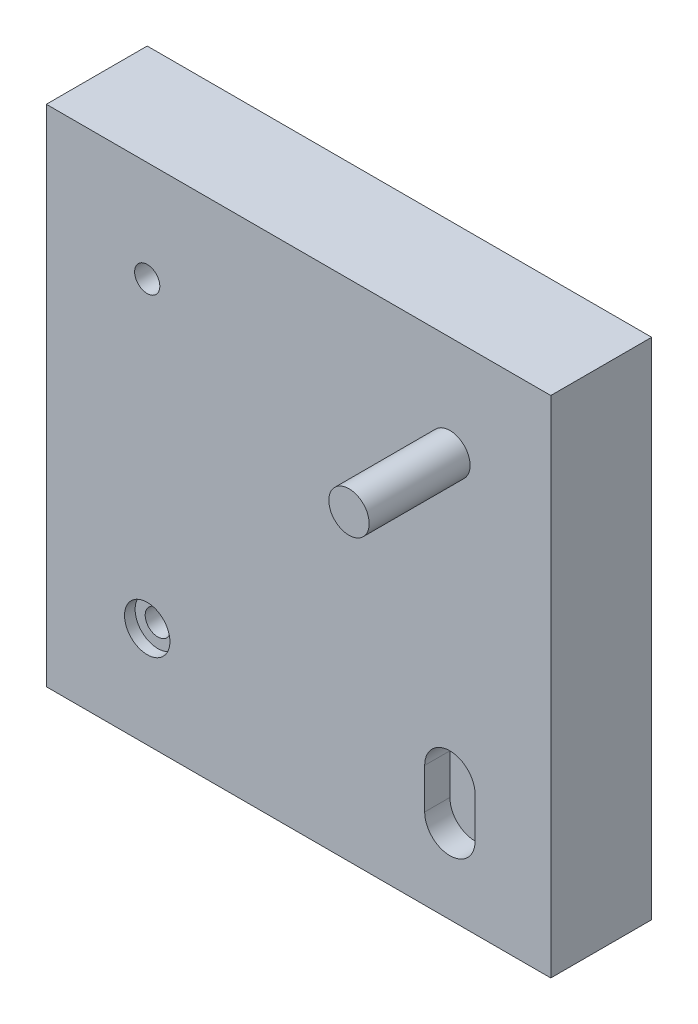
from build123d import *

# Parameters (mm, degrees)
SKIZZE1_W                       = 100
SKIZZE1_H                       = 100
AUFSATZ_LINEAR_AUSTRAGEN1_DEPTH = 20
F_5_0MM_STIFTLOCH1_D            = 5
F_5_0MM_STIFTLOCH1_DEPTH        = 8.5
F_5_0MM_STIFTLOCH1_TIP          = 1.502151548
SKIZZE5_R                       = 4
AUFSATZ_LINEAR_AUSTRAGEN2_DEPTH = 20
BOHRUNG1_D                      = 5
BOHRUNG1_DEPTH                  = 20
BOHRUNG1_CBORE_D                = 9
BOHRUNG1_CBORE_DEPTH            = 2.1
BOHRUNG1_TIP                    = 1.502151548
SCHNITT_LINEAR_AUSTRAGEN1_DEPTH = 5


with BuildPart() as part:
    # Skizze1 → Aufsatz-Linear austragen1 (new body)
    with BuildSketch(Plane.XY):
        Rectangle(SKIZZE1_W, SKIZZE1_H)
    extrude(amount=AUFSATZ_LINEAR_AUSTRAGEN1_DEPTH)

    # Ø5.0mm Stiftloch1
    with Locations(Plane.XY.offset(20)):
        with Locations((-30, 30)):
            Hole(F_5_0MM_STIFTLOCH1_D / 2, depth=F_5_0MM_STIFTLOCH1_DEPTH)
            with Locations((0, 0, -(F_5_0MM_STIFTLOCH1_DEPTH + F_5_0MM_STIFTLOCH1_TIP / 2))):  # 118° drill point
                Cone(0, F_5_0MM_STIFTLOCH1_D / 2, F_5_0MM_STIFTLOCH1_TIP, mode=Mode.SUBTRACT)

    # Skizze5 → Aufsatz-Linear austragen2 (add)
    with BuildSketch(Plane.XY.offset(20)):
        with Locations(Location((30, 30, 0), (0, 0, 180))):
            Circle(SKIZZE5_R)
    extrude(amount=AUFSATZ_LINEAR_AUSTRAGEN2_DEPTH)

    # Bohrung1
    with Locations(Plane.XY.offset(20)):
        with Locations((-30, -30)):
            CounterBoreHole(BOHRUNG1_D / 2, BOHRUNG1_CBORE_D / 2, BOHRUNG1_CBORE_DEPTH, depth=BOHRUNG1_DEPTH)
            with Locations((0, 0, -(BOHRUNG1_DEPTH + BOHRUNG1_TIP / 2))):  # 118° drill point
                Cone(0, BOHRUNG1_D / 2, BOHRUNG1_TIP, mode=Mode.SUBTRACT)

    # Skizze9 → Schnitt-Linear austragen1 (cut)
    with BuildSketch(Plane.XY.offset(20)):
        with BuildLine():
            Line((25, -34), (25, -26))
            ThreePointArc((25, -26), (30, -21), (35, -26))
            Line((35, -26), (35, -34))
            ThreePointArc((35, -34), (30, -39), (25, -34))
        make_face()
    extrude(amount=-SCHNITT_LINEAR_AUSTRAGEN1_DEPTH, mode=Mode.SUBTRACT)


solid = part.part
